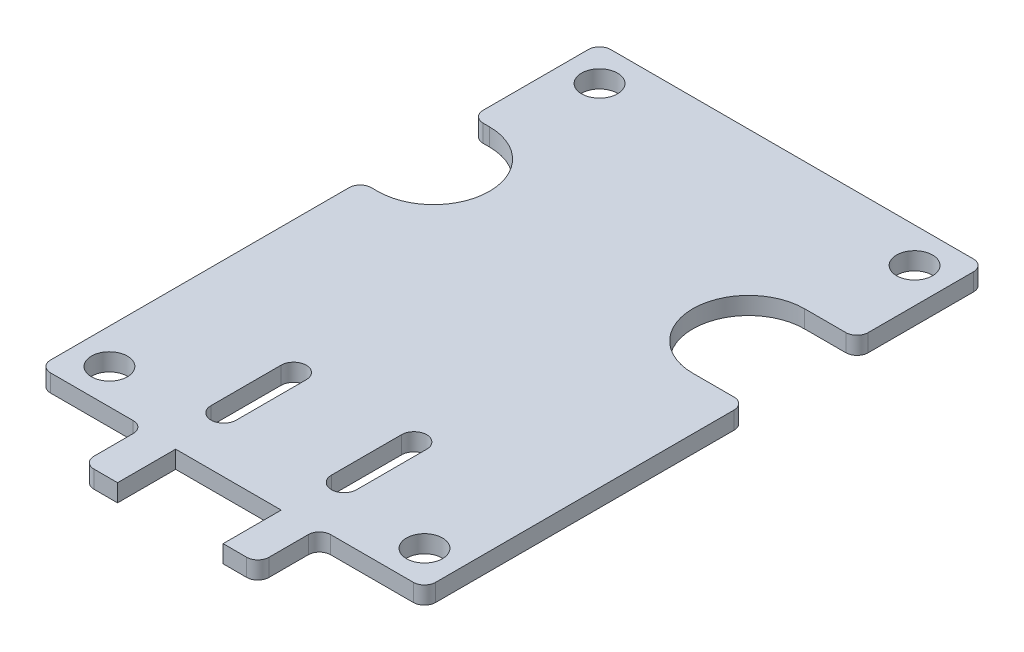
from build123d import *

# Parameters (mm, degrees)
SKETCH1_W             = 34.925
SKETCH1_H             = 50.8
BOSS_EXTRUDE1_DEPTH   = 1.5875
F_4_CLEARANCE_HOLE1_D = 3.2639
SKETCH6_W             = 15.875
SKETCH6_H             = 5.588
BOSS_EXTRUDE2_DEPTH   = 1.5875
CUT_EXTRUDE1_DEPTH    = 36.604988506
CUT_EXTRUDE2_DEPTH    = 36.604988506
SKETCH9_W             = 9.573595876
SKETCH9_H             = 10.540114366
CUT_EXTRUDE3_DEPTH    = 36.604988506
FILLET1_R             = 1.016


with BuildPart() as part:
    # Sketch1 → Boss-Extrude1 (new body)
    with BuildSketch(Plane(origin=(0, 0, 0), x_dir=(1, 0, 0), z_dir=(0, 1, 0))):
        Rectangle(SKETCH1_W, SKETCH1_H)
    extrude(amount=BOSS_EXTRUDE1_DEPTH)

    # #4 Clearance Hole1 (through all)
    with Locations(Plane(origin=(0, 1.5875, 0), x_dir=(1, 0, 0), z_dir=(0, 1, 0))):
        with Locations((-14.2875, 22.225), (14.2875, 22.225), (14.2875, -22.225), (-14.2875, -22.225)):
            Hole(F_4_CLEARANCE_HOLE1_D / 2)

    # Sketch6 → Boss-Extrude2 (add)
    with BuildSketch(Plane(origin=(0, 1.5875, 0), x_dir=(1, 0, 0), z_dir=(0, 1, 0))):
        with Locations((0, -28.194)):
            Rectangle(SKETCH6_W, SKETCH6_H)
    extrude(amount=-BOSS_EXTRUDE2_DEPTH)

    # Sketch7 → Cut-Extrude1 (cut, through all)
    with BuildSketch(Plane(origin=(0, 1.5875, 0), x_dir=(1, 0, 0), z_dir=(0, 1, 0))):
        with BuildLine():
            Line((-15.875, 13.8303), (-20.9423, 13.8303))
            Line((-20.9423, 13.8303), (-20.9423, 8.763))
            Line((-20.9423, 8.763), (-20.9423, 3.6957))
            Line((-20.9423, 3.6957), (-15.875, 3.6957))
            ThreePointArc((-15.875, 3.6957), (-10.8077, 8.763), (-15.875, 13.8303))
        make_face()
        with BuildLine():
            Line((12.7, 13.8303), (17.7673, 13.8303))
            Line((17.7673, 13.8303), (17.7673, 8.763))
            Line((17.7673, 8.763), (17.7673, 3.6957))
            Line((17.7673, 3.6957), (12.7, 3.6957))
            ThreePointArc((12.7, 3.6957), (7.6327, 8.763), (12.7, 13.8303))
        make_face()
    extrude(amount=-CUT_EXTRUDE1_DEPTH, mode=Mode.SUBTRACT)

    # Sketch8 → Cut-Extrude2 (cut, through all)
    with BuildSketch(Plane(origin=(0, 1.5875, 0), x_dir=(1, 0, 0), z_dir=(0, 1, 0))):
        with BuildLine():
            Line((6.604, -14.342881029), (6.604, -20.692881029))
            ThreePointArc((6.604, -20.692881029), (5.461, -21.835881029), (4.318, -20.692881029))
            Line((4.318, -20.692881029), (4.318, -14.342881029))
            ThreePointArc((4.318, -14.342881029), (5.461, -13.199881029), (6.604, -14.342881029))
        make_face()
    cut_extrude2 = extrude(amount=-CUT_EXTRUDE2_DEPTH, mode=Mode.SUBTRACT)

    # Mirror1: Cut-Extrude2 across plane
    add(cut_extrude2.mirror(Plane(origin=(0, 0, 0), x_dir=(0, 0, 1), z_dir=(1, 0, 0))), mode=Mode.SUBTRACT)

    # Sketch9 → Cut-Extrude3 (cut, through all)
    with BuildSketch(Plane.XZ):
        with Locations((0, 30.988)):
            Rectangle(SKETCH9_W, SKETCH9_H)
    extrude(amount=-CUT_EXTRUDE3_DEPTH, mode=Mode.SUBTRACT)

    # Fillet1
    fillet1_edges = [part.edges().sort_by_distance(p)[0] for p in [
        (-7.9375, 0.79375, 25.4),
        (7.9375, 0.79375, 25.4),
        (7.9375, 0.79375, 30.988),
        (-7.9375, 0.79375, 30.988),
        (-17.4625, 0.79375, -3.6957),
        (-17.4625, 0.79375, -13.8303),
        (17.4625, 0.79375, -13.8303),
        (17.4625, 0.79375, -3.6957),
        (-17.4625, 0.79375, 25.4),
        (-17.4625, 0.79375, -25.4),
        (17.4625, 0.79375, -25.4),
        (17.4625, 0.79375, 25.4),
    ]]
    fillet(fillet1_edges, radius=FILLET1_R)


solid = part.part
